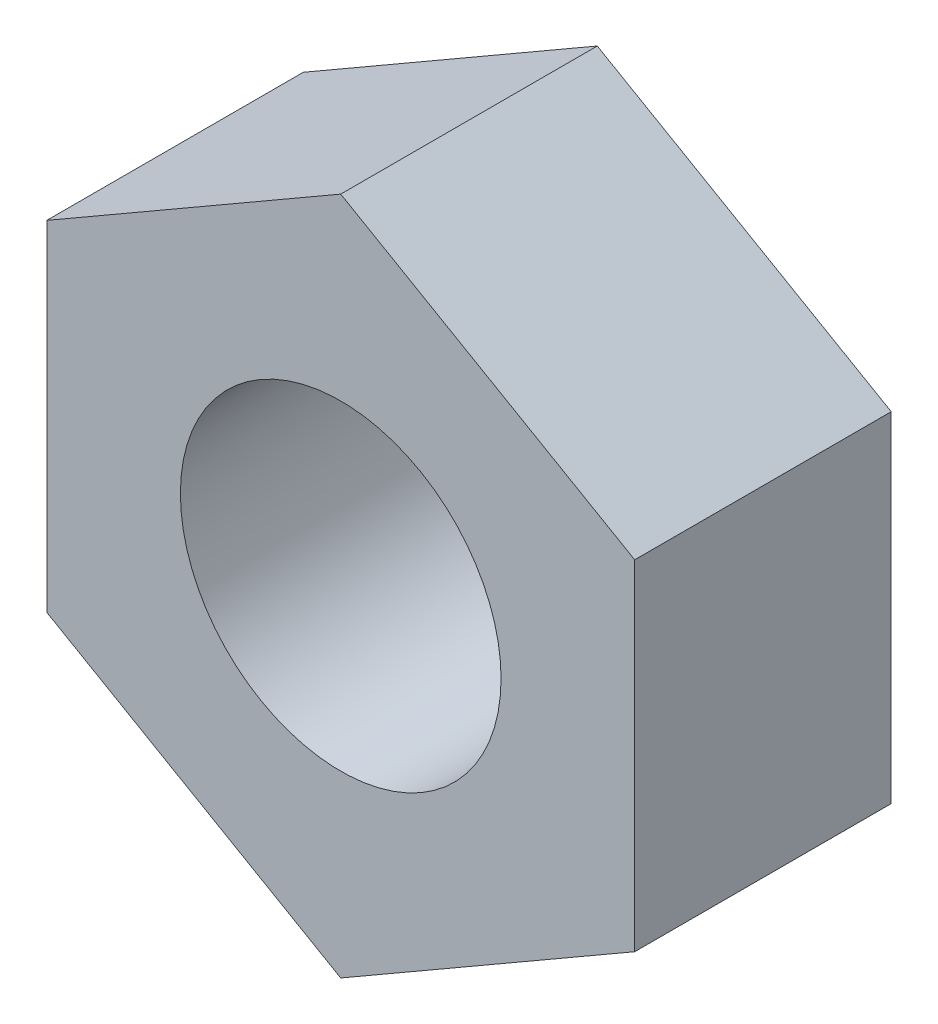
from build123d import *

# Parameters (mm, degrees)
SKETCH_1_R      = 1.5
EXTRUDE_1_DEPTH = 2.4


with BuildPart() as part:
    # 草图1 → 凸台-拉伸1 (new body)
    with BuildSketch(Plane.XY):
        Polygon((0, -3.175426481), (2.75, -1.58771324), (2.75, 1.58771324), (0, 3.175426481), (-2.75, 1.58771324), (-2.75, -1.58771324), align=None)
        Circle(SKETCH_1_R, mode=Mode.SUBTRACT)
    extrude(amount=EXTRUDE_1_DEPTH)


solid = part.part
